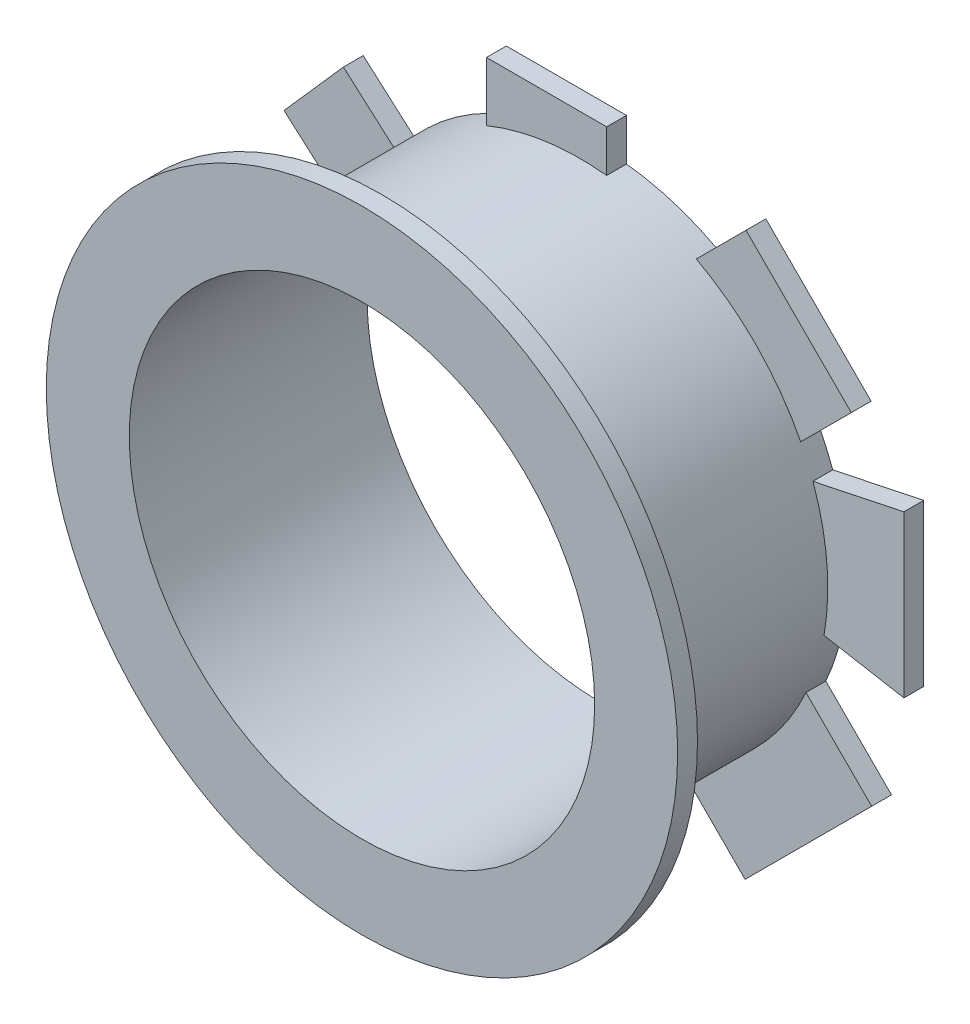
from build123d import *

# Parameters (mm, degrees)
SKICA1_R                 = 1.25
P_IDAT_VYSUNUT_M1_DEPTH  = 1
SKICA2_R                 = 1.173786911
ODEBRAT_VYSUNUT_M1_DEPTH = 10
P_IDAT_START             = 0.1
SKICA3_R                 = 1.592540519
SKICA3_R_2               = 1.173786911
P_IDAT_VYSUNUT_M2_DEPTH  = 0.1
SKICA4_R                 = 1.173786911
P_IDAT_VYSUNUT_M3_DEPTH  = 0.1


with BuildPart() as part:
    # Skica1 → Přidat vysunutím1 (new body)
    with BuildSketch(Plane.XY):
        Circle(SKICA1_R)
    extrude(amount=P_IDAT_VYSUNUT_M1_DEPTH)

    # Skica2 → Odebrat vysunutím1 (cut)
    with BuildSketch(Plane.XY.offset(1)):
        Circle(SKICA2_R)
    extrude(amount=-ODEBRAT_VYSUNUT_M1_DEPTH, mode=Mode.SUBTRACT)

    # Skica3 → Přidat vysunutím2 (add)
    with BuildSketch(Plane.XY.offset(1).offset(P_IDAT_START)):
        Circle(SKICA3_R)
        Circle(SKICA3_R_2, mode=Mode.SUBTRACT)
    extrude(amount=-P_IDAT_VYSUNUT_M2_DEPTH)

    # Skica4 → Přidat vysunutím3 (add)
    with BuildSketch(Plane(origin=(0, 0, 0), x_dir=(-1, 0, 0), z_dir=(0, 0, -1)).offset(P_IDAT_START)):
        with BuildLine():
            Line((-0.134315846, 1.24276275), (-0.134315846, 1.455404156))
            Line((-0.134315846, 1.455404156), (0.471854701, 1.455404156))
            Line((0.471854701, 1.455404156), (0.471854701, 1.157520255))
            ThreePointArc((0.471854701, 1.157520255), (0.723799345, 1.019124383), (0.937467385, 0.826834266))
            Line((0.937467385, 0.826834266), (1.193570715, 1.052714134))
            Line((1.193570715, 1.052714134), (1.493085883, 0.71312286))
            Line((1.493085883, 0.71312286), (1.173313122, 0.431087367))
            ThreePointArc((1.173313122, 0.431087367), (1.219641203, 0.273816243), (1.244987165, 0.111834515))
            Line((1.244987165, 0.111834515), (1.375237606, 0.091671596))
            Line((1.375237606, 0.091671596), (1.375237606, 0))
            Line((1.375237606, 0), (1.25, 0))
            ThreePointArc((1.25, 0), (1.234641469, -0.19534698), (1.188943292, -0.385893572))
            Line((1.188943292, -0.385893572), (1.521394679, -0.71171305))
            ThreePointArc((1.521394679, -0.71171305), (1.545394832, -0.768042668), (1.522534448, -0.824844394))
            Line((1.522534448, -0.824844394), (1.188943292, -1.165225648))
            Line((1.188943292, -1.165225648), (0.892743068, -0.874934177))
            ThreePointArc((0.892743068, -0.874934177), (0.688100113, -1.043560365), (0.452492198, -1.165225648))
            Line((0.452492198, -1.165225648), (0.554420085, -1.427703077))
            Line((0.554420085, -1.427703077), (-0.095705572, -1.483046114))
            Line((-0.095705572, -1.483046114), (-0.13304786, -1.242899138))
            ThreePointArc((-0.13304786, -1.242899138), (-0.31854859, -1.208729414), (-0.496795977, -1.147036947))
            Line((-0.496795977, -1.147036947), (-0.832805143, -1.483046114))
            Line((-0.832805143, -1.483046114), (-1.471238112, -0.844613145))
            Line((-1.471238112, -0.844613145), (-1.139802222, -0.513177255))
            ThreePointArc((-1.139802222, -0.513177255), (-1.194422371, -0.368585403), (-1.230780155, -0.218357988))
            Line((-1.230780155, -0.218357988), (-1.633865576, -0.289871103))
            Line((-1.633865576, -0.289871103), (-1.633865576, 0.523252679))
            Line((-1.633865576, 0.523252679), (-1.174778121, 0.427078876))
            ThreePointArc((-1.174778121, 0.427078876), (-1.14617393, 0.498783843), (-1.113197918, 0.568586312))
            Line((-1.113197918, 0.568586312), (-1.368475858, 0.823864252))
            Line((-1.368475858, 0.823864252), (-0.837363868, 1.354976242))
            Line((-0.837363868, 1.354976242), (-0.586338391, 1.103950765))
            ThreePointArc((-0.586338391, 1.103950765), (-0.36695071, 1.194925594), (-0.134315846, 1.24276275))
        make_face()
        with Locations(Location((0, 0, 0), (0, 0, 180))):
            Circle(SKICA4_R, mode=Mode.SUBTRACT)
    extrude(amount=-P_IDAT_VYSUNUT_M3_DEPTH)


solid = part.part
